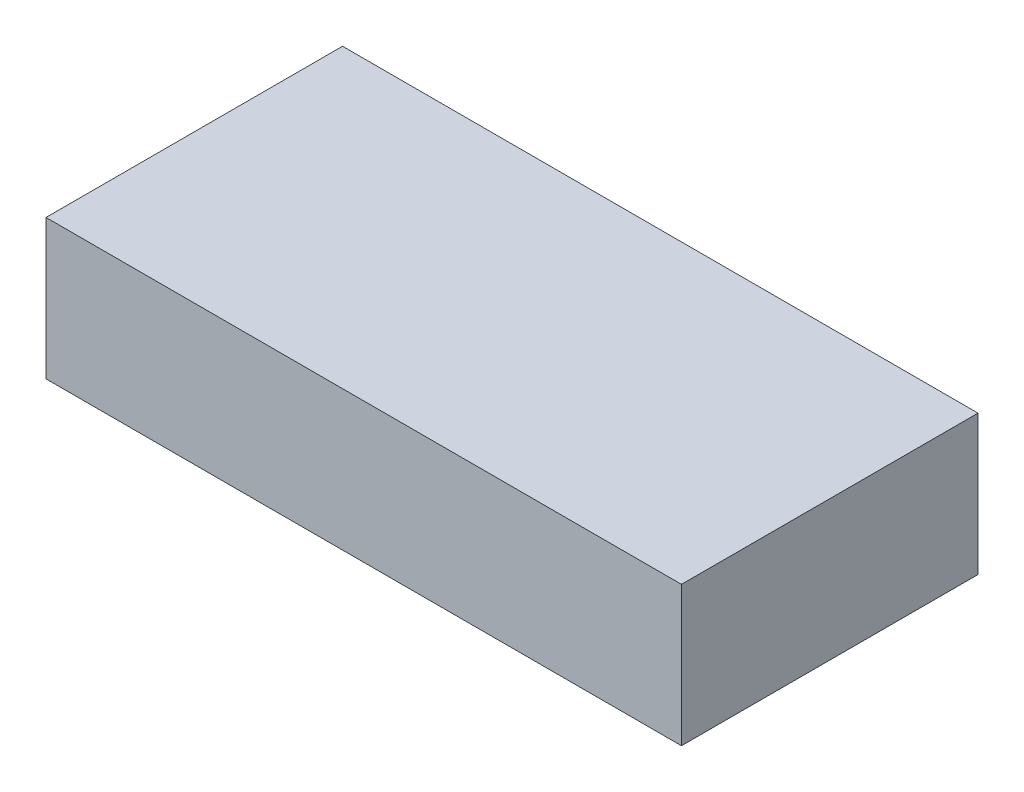
from build123d import *

# Parameters (mm, degrees)
SKETCH1_W           = 38.1
SKETCH1_H           = 17.78
BOSS_EXTRUDE1_DEPTH = 8.382


with BuildPart() as part:
    # Sketch1 → Boss-Extrude1 (new body)
    with BuildSketch(Plane(origin=(0, 0, 0), x_dir=(1, 0, 0), z_dir=(0, 1, 0))):
        Rectangle(SKETCH1_W, SKETCH1_H)
    extrude(amount=BOSS_EXTRUDE1_DEPTH)


solid = part.part
